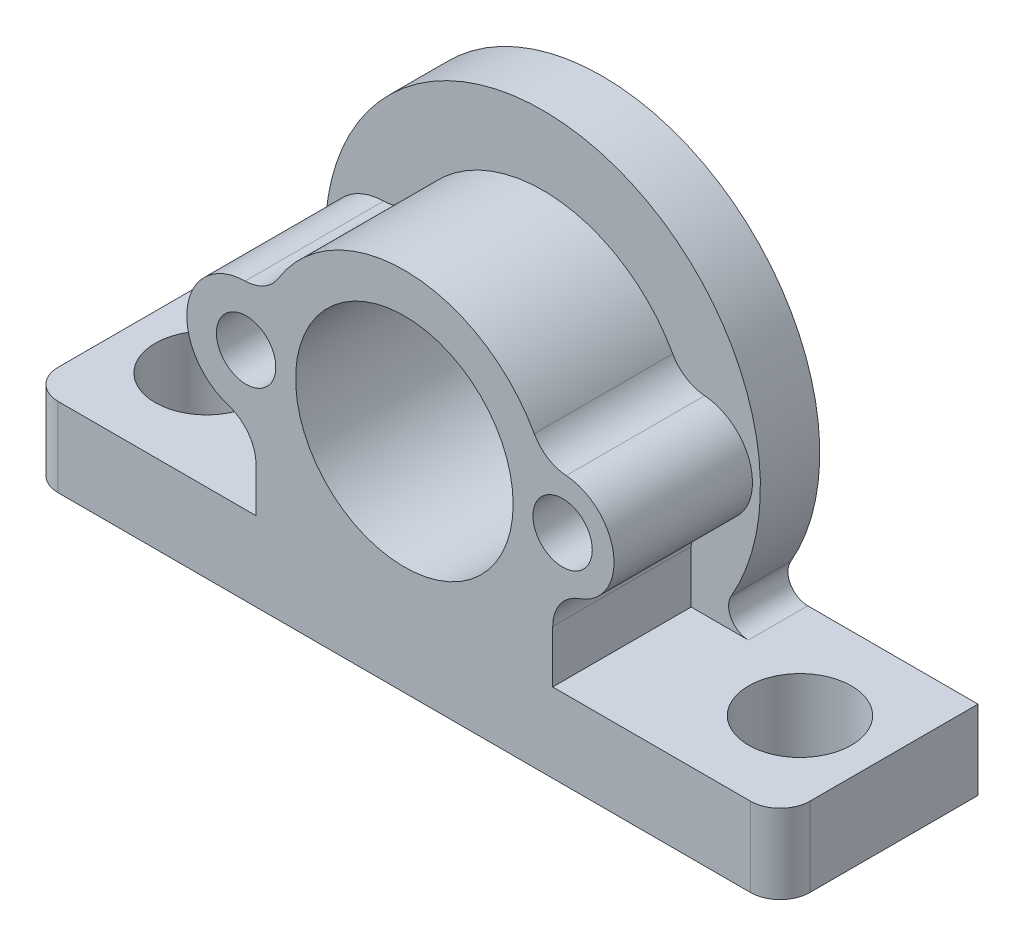
from build123d import *
from build123d.topology import SkipClean

# Parameters (mm, degrees)
SKETCH1_R           = 5.5
BOSS_EXTRUDE1_DEPTH = 10
SKETCH2_R           = 2.6
CUT_EXTRUDE1_DEPTH  = 26.908492816
SKETCH3_R           = 11
SKETCH3_R_2         = 5.5
BOSS_EXTRUDE2_DEPTH = 3
SKETCH4_R           = 1.5
CUT_EXTRUDE2_DEPTH  = 25.124676164
BOSS_EXTRUDE3_REACH = 26.125
FILLET1_R           = 2
FILLET2_R           = 1.5
FILLET3_R           = 1


with BuildPart() as part:
    # Sketch1 → Boss-Extrude1 (new body)
    with BuildSketch(Plane.XY):
        with BuildLine():
            Line((19, -11), (19, -7))
            Line((19, -7), (7.5, -7))
            Line((7.5, -7), (7.5, 0))
            ThreePointArc((7.5, 0), (0, 7.5), (-7.5, 0))
            Line((-7.5, 0), (-7.5, -7))
            Line((-7.5, -7), (-19, -7))
            Line((-19, -7), (-19, -11))
            Line((-19, -11), (19, -11))
        make_face()
        Circle(SKETCH1_R, mode=Mode.SUBTRACT)
    extrude(amount=BOSS_EXTRUDE1_DEPTH)

    # Sketch2 → Cut-Extrude1 (cut, through all)
    with BuildSketch(Plane(origin=(0, -7, 0), x_dir=(1, 0, 0), z_dir=(0, 1, 0))):
        with Locations(Location((-15, -5, 0), (0, 0, 270))):
            Circle(SKETCH2_R)
        with Locations(Location((15, -5, 0), (0, 0, 90))):
            Circle(SKETCH2_R)
    extrude(amount=-CUT_EXTRUDE1_DEPTH, mode=Mode.SUBTRACT)

    # Sketch3 → Boss-Extrude2 (add)
    with BuildSketch(Plane(origin=(0, 0, 0), x_dir=(-1, 0, 0), z_dir=(0, 0, -1))):
        Circle(SKETCH3_R)
        with Locations(Location((0, 0, 0), (0, 0, 180))):
            Circle(SKETCH3_R_2, mode=Mode.SUBTRACT)
    extrude(amount=-BOSS_EXTRUDE2_DEPTH)

    # Sketch4 → Cut-Extrude2 (cut, through all)
    with BuildSketch(Plane(origin=(0, 0, 0), x_dir=(-1, 0, 0), z_dir=(0, 0, -1))):
        with Locations((8, 0)):
            Circle(SKETCH4_R)
        with Locations(Location((-8, 0, 0), (0, 0, 65.375681648))):
            Circle(SKETCH4_R)
    extrude(amount=-CUT_EXTRUDE2_DEPTH, mode=Mode.SUBTRACT)

    # Sketch5 → Boss-Extrude3 (add, up to next)
    with BuildSketch(Plane.XY.offset(10), mode=Mode.PRIVATE) as boss_extrude3_sk1:
        with BuildLine():
            ThreePointArc((-7.375, 1.363589014), (-7.200544516, 2.098132188), (-6.953125, 2.811414721))
            ThreePointArc((-6.953125, 2.811414721), (-10.986612998, 0.28309504), (-7.5, -2.958039892))
            Line((-7.5, -2.958039892), (-7.5, -1.414213562))
            ThreePointArc((-7.5, -1.414213562), (-9.49848358, 0.067431159), (-7.375, 1.363589014))
        make_face()
    boss_extrude3_tool1 = extrude(boss_extrude3_sk1.sketch, amount=-BOSS_EXTRUDE3_REACH, mode=Mode.PRIVATE) - part.part
    # Sketch5 → Boss-Extrude3 (add, up to next)
    with BuildSketch(Plane.XY.offset(10), mode=Mode.PRIVATE) as boss_extrude3_sk2:
        with BuildLine():
            ThreePointArc((7.5, -2.551470164), (9.652271164, -2.00748599), (10.6, 0))
            ThreePointArc((10.6, 0), (9.483597823, 2.135166855), (7.093125, 2.436714537))
            ThreePointArc((7.093125, 2.436714537), (7.253934095, 1.905371394), (7.375, 1.363589014))
            ThreePointArc((7.375, 1.363589014), (8.810092587, 1.262438117), (9.5, 0))
            ThreePointArc((9.5, 0), (8.866025404, -1.224744871), (7.5, -1.414213562))
            Line((7.5, -1.414213562), (7.5, -2.551470164))
        make_face()
    boss_extrude3_tool2 = extrude(boss_extrude3_sk2.sketch, amount=-BOSS_EXTRUDE3_REACH, mode=Mode.PRIVATE) - part.part
    add(boss_extrude3_tool1.solids().sort_by_distance((-10.914564, 0.276266, 10))[0])
    add(boss_extrude3_tool2.solids().sort_by_distance((9.612413, -1.959059, 10))[0])

    # Fillet1
    fillet1_edges = [part.edges().sort_by_distance(p)[0] for p in [
        (7.093125, 2.436714537, 6.5),
        (7.5, -2.551470164, 6.5),
        (-7.5, -2.958039892, 6.5),
        (-6.953125, 2.811414721, 6.5),
    ]]
    fillet(fillet1_edges, radius=FILLET1_R)

    # Fillet2
    fillet2_edges = [part.edges().sort_by_distance(p)[0] for p in [
        (-19, -9, 10),
        (19, -9, 10),
    ]]
    fillet(fillet2_edges, radius=FILLET2_R)

    # Fillet3
    fillet3_edges = [part.edges().sort_by_distance(p)[0] for p in [
        (-8.485281374, -7, 1.5),
        (8.485281374, -7, 1.5),
    ]]
    fillet(fillet3_edges, radius=FILLET3_R)


solid = part.part
